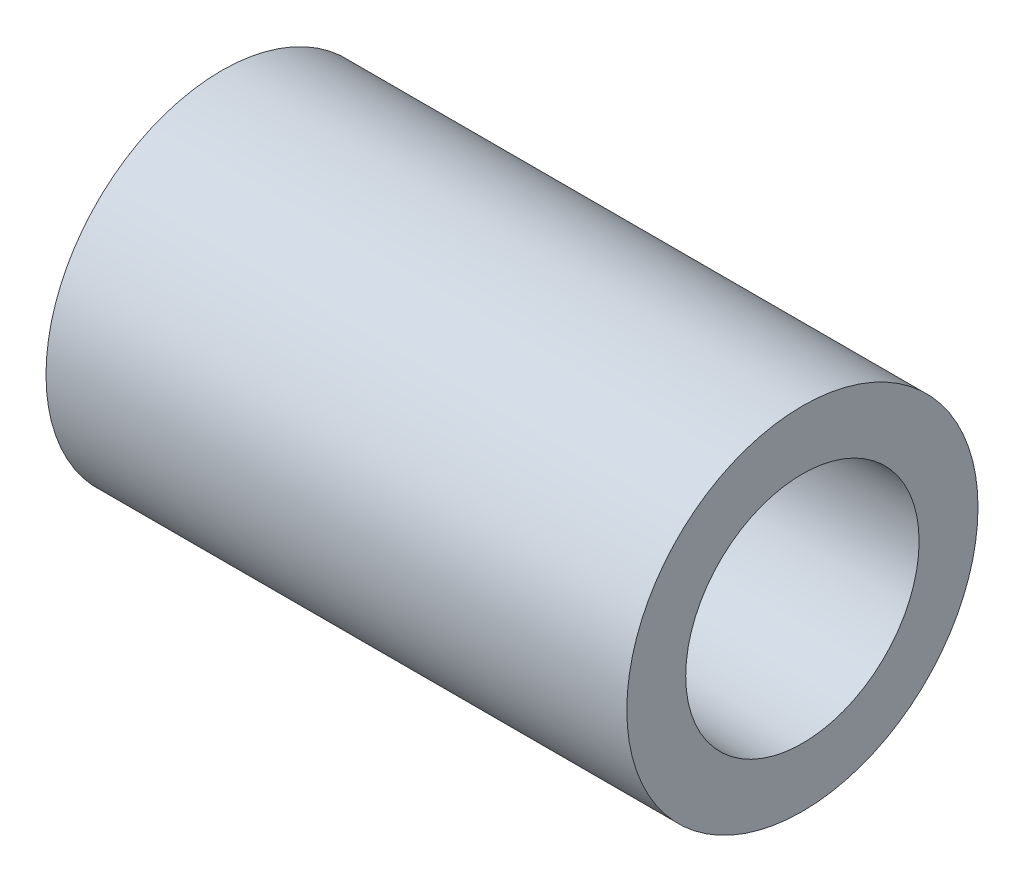
from build123d import *

# Parameters (mm, degrees)
BOSS_EXTRUDE1_START = 3.96875
SKETCH3_R           = 10.31875
BOSS_EXTRUDE1_DEPTH = 3.96875


with BuildPart() as part:
    # Sketch1 → Revolve1 (revolve)
    with BuildSketch(Plane.XY, mode=Mode.PRIVATE) as revolve1_sk:
        Polygon((-17.065625, -10.31875), (-1.984375, -10.31875), (-1.984375, -6.388443876), (-17.065625, -6.858), align=None)
    revolve(revolve1_sk.sketch.rotate(Axis((-17.065625, 0, 0), (1, 0, 0)), 270), axis=Axis((-17.065625, 0, 0), (1, 0, 0)))


with BuildPart() as body_2:
    # Mirror2: mirrored copy
    add(part.part.mirror(Plane(origin=(0, 0, 0), x_dir=(0, 0, 1), z_dir=(1, 0, 0))))


with BuildPart() as part_1:
    add(part.part)

    add(body_2.part)  # Boss-Extrude1 merges body 2
    # Sketch3 → Boss-Extrude1 (add)
    with BuildSketch(Plane(origin=(-1.984375, 0, 0), x_dir=(0, 0, -1), z_dir=(1, 0, 0)).offset(BOSS_EXTRUDE1_START)):
        with Locations(Location((0, 0, 0), (0, 0, 180))):
            Circle(SKETCH3_R)
    extrude(amount=-BOSS_EXTRUDE1_DEPTH)

    # Sketch8 → Cut-Revolve1 (revolve, cut)
    with BuildSketch(Plane.XY):
        Polygon((-17.065625, 0), (17.065625, 0), (17.065625, -6.858), (1.984375, -6.388443876), (1.984375, -3.365843876), (-1.984375, -3.365843876), (-1.984375, -6.388443876), (-17.065625, -6.858), align=None)
    revolve(axis=Axis((-17.065625, 0, 0), (1, 0, 0)), mode=Mode.SUBTRACT)


solid = part_1.part
